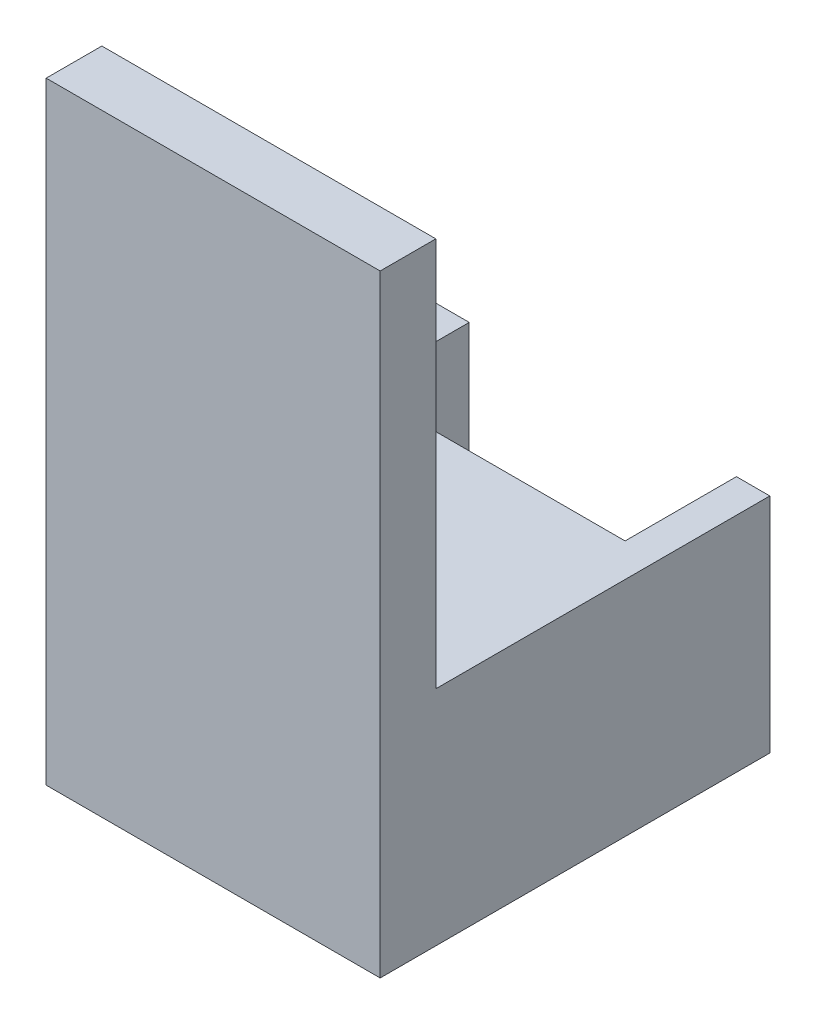
from build123d import *

# Parameters (mm, degrees)
BOSS_EXTRUDE1_DEPTH = 20
SKETCH4_W           = 30
SKETCH4_H           = 5
BOSS_EXTRUDE3_DEPTH = 35


with BuildPart() as part:
    # Sketch1 → Boss-Extrude1 (new body)
    with BuildSketch(Plane(origin=(0, 0, 0), x_dir=(1, 0, 0), z_dir=(0, 1, 0))):
        Polygon((27, 35), (30, 35), (30, 0), (0, 0), (0, 35), (3, 35), (3, 25), (27, 25), align=None)
    extrude(amount=BOSS_EXTRUDE1_DEPTH)

    # Sketch4 → Boss-Extrude3 (add)
    with BuildSketch(Plane(origin=(0, 20, 0), x_dir=(1, 0, 0), z_dir=(0, 1, 0))):
        with Locations((15, 2.5)):
            Rectangle(SKETCH4_W, SKETCH4_H)
    extrude(amount=BOSS_EXTRUDE3_DEPTH)


solid = part.part
